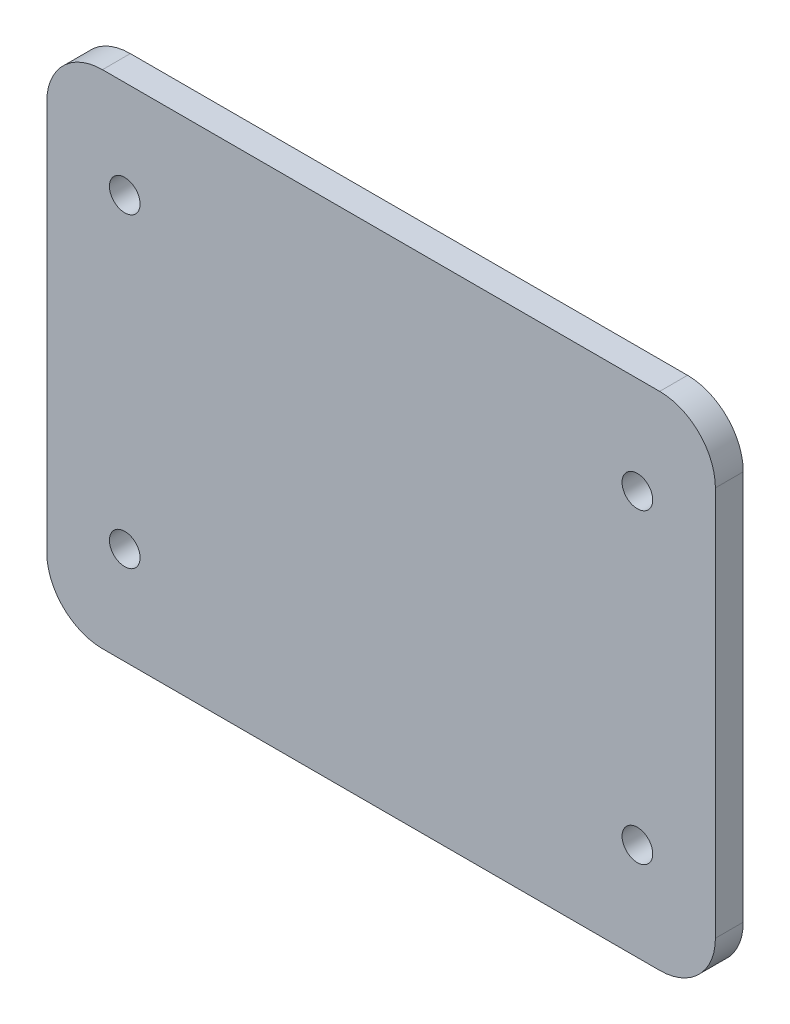
from build123d import *

# Parameters (mm, degrees)
SKETCH_1_W      = 120
SKETCH_1_H      = 90
SKETCH_1_R      = 2.75
EXTRUDE_1_DEPTH = 5
FILLET_1_R      = 10


with BuildPart() as part:
    # 草图1 → 凸台-拉伸1 (new body)
    with BuildSketch(Plane.XY):
        with Locations((19.14893617, -16.787234043)):
            Rectangle(SKETCH_1_W, SKETCH_1_H)
        with Locations((-26.85106383, -44.287234043)):
            Circle(SKETCH_1_R, mode=Mode.SUBTRACT)
        with Locations((65.14893617, -44.287234043)):
            Circle(SKETCH_1_R, mode=Mode.SUBTRACT)
        with Locations((-26.85106383, 10.712765957)):
            Circle(SKETCH_1_R, mode=Mode.SUBTRACT)
        with Locations((65.14893617, 10.712765957)):
            Circle(SKETCH_1_R, mode=Mode.SUBTRACT)
    extrude(amount=EXTRUDE_1_DEPTH)

    # 圆角1
    fillet_1_edges = [part.edges().sort_by_distance(p)[0] for p in [
        (-40.85106383, -61.787234043, 2.5),
        (-40.85106383, 28.212765957, 2.5),
        (79.14893617, 28.212765957, 2.5),
        (79.14893617, -61.787234043, 2.5),
    ]]
    fillet(fillet_1_edges, radius=FILLET_1_R)


solid = part.part
